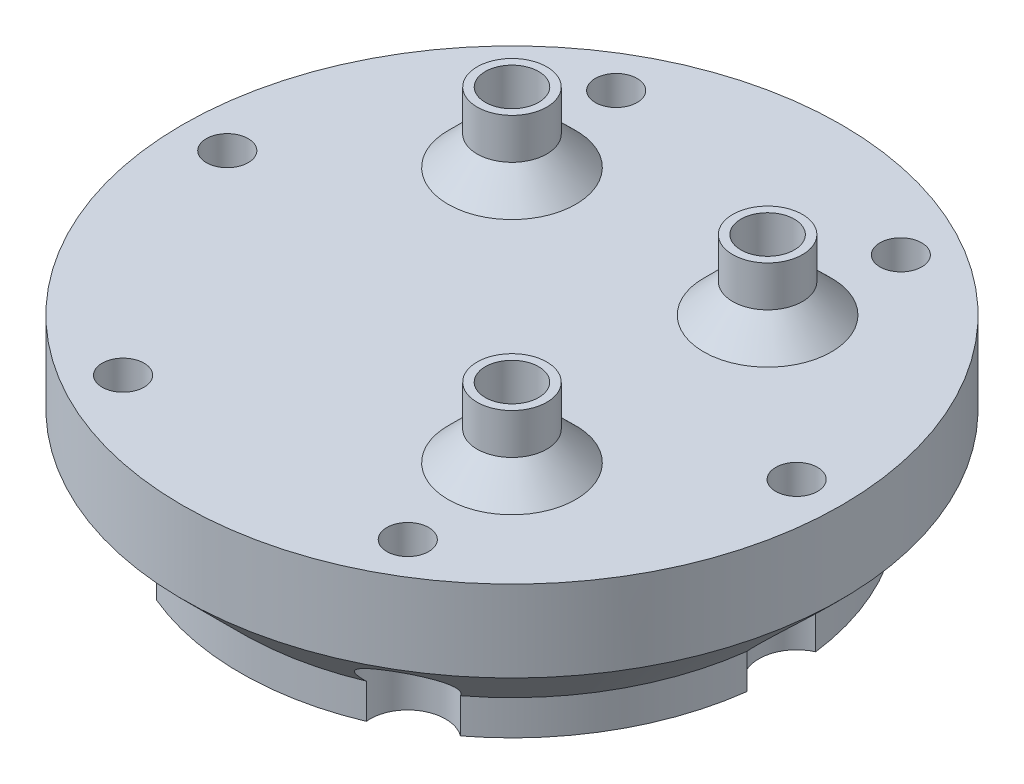
from build123d import *

# Parameters (mm, degrees)
CBORE_FOR_M3_HEX_SOCKET_HEAD_CAP_SCREW1_D           = 3.6
CBORE_FOR_M3_HEX_SOCKET_HEAD_CAP_SCREW1_CBORE_D     = 6.5
CBORE_FOR_M3_HEX_SOCKET_HEAD_CAP_SCREW1_CBORE_DEPTH = 10.4
HOLEWZD2_D                                          = 4.6
HOLEWZD2_DEPTH                                      = 7
HOLEWZD2_TIP                                        = 2.3
SKETCH9_R                                           = 3
BOSS_EXTRUDE1_DEPTH                                 = 6
HOLEWZD1_D                                          = 4.6
HOLEWZD1_DEPTH                                      = 7
CHAMFER1_SIZE                                       = 2.5


with BuildPart() as part:
    # Sketch3 → Revolve1 (revolve)
    with BuildSketch(Plane.XY, mode=Mode.PRIVATE) as revolve1_sk:
        Polygon((0, 0), (23.365, 0), (23.365, 3), (28.365, 8), (28.365, 15), (0, 15), align=None)
    revolve(revolve1_sk.sketch.rotate(Axis((0, 0, 0), (0, 1, 0)), 90), axis=Axis((0, 0, 0), (0, 1, 0)))

    # CBORE for M3 Hex Socket Head Cap Screw1 (through all)
    with Locations(Plane(origin=(0, 0, 0), x_dir=(-1, 0, 0), z_dir=(0, -1, 0))):
        with Locations((-24.5, 0), (12.25, 21.217622393), (-12.25, 21.217622393), (-12.25, -21.217622393), (12.25, -21.217622393), (24.5, 0)):
            CounterBoreHole(CBORE_FOR_M3_HEX_SOCKET_HEAD_CAP_SCREW1_D / 2, CBORE_FOR_M3_HEX_SOCKET_HEAD_CAP_SCREW1_CBORE_D / 2, CBORE_FOR_M3_HEX_SOCKET_HEAD_CAP_SCREW1_CBORE_DEPTH)

    # HoleWzd2
    with Locations(Plane(origin=(0, 0, 0), x_dir=(-1, 0, 0), z_dir=(0, -1, 0))):
        with Locations((-12.8, 0), (0, 12.8), (12.8, 0), (0, -12.8)):
            Hole(HOLEWZD2_D / 2, depth=HOLEWZD2_DEPTH)
            with Locations((0, 0, -(HOLEWZD2_DEPTH + HOLEWZD2_TIP / 2))):  # 90° drill point
                Cone(0, HOLEWZD2_D / 2, HOLEWZD2_TIP, mode=Mode.SUBTRACT)

    # Sketch9 → Boss-Extrude1 (add)
    with BuildSketch(Plane(origin=(0, 15, 0), x_dir=(1, 0, 0), z_dir=(0, 1, 0))):
        with Locations(Location((-11, 11, 0), (0, 0, 270))):
            Circle(SKETCH9_R)
        with Locations(Location((11, 11, 0), (0, 0, 270))):
            Circle(SKETCH9_R)
        with Locations(Location((11, -11, 0), (0, 0, 270))):
            Circle(SKETCH9_R)
    extrude(amount=BOSS_EXTRUDE1_DEPTH)

    # HoleWzd1
    with Locations(Plane(origin=(0, 21, 0), x_dir=(1, 0, 0), z_dir=(0, 1, 0))):
        with Locations((11, -11), (11, 11), (-11, 11)):
            Hole(HOLEWZD1_D / 2, depth=HOLEWZD1_DEPTH)

    # Chamfer1
    chamfer1_edges = [part.edges().sort_by_distance(p)[0] for p in [
        (-11, 15, -14),
        (11, 15, -14),
        (11, 15, 8),
    ]]
    chamfer(chamfer1_edges, length=CHAMFER1_SIZE)


solid = part.part
